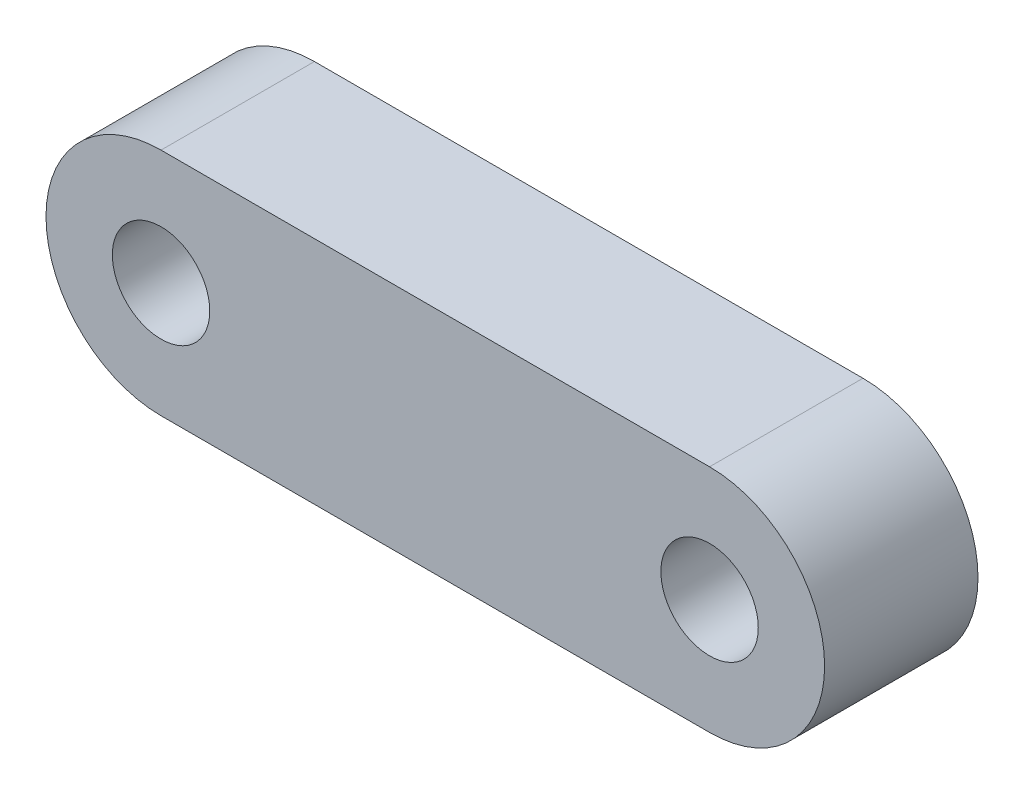
from build123d import *

# Parameters (mm, degrees)
BOSS_EXTRUDE1_DEPTH = 2.5
SKETCH2_R           = 1.5875
CUT_EXTRUDE1_DEPTH  = 15.145621231


with BuildPart() as part:
    # Sketch1 → Boss-Extrude1 (new, symmetric)
    with BuildSketch(Plane.XY):
        with BuildLine():
            Line((-8.94, 3.75), (8.94, 3.75))
            ThreePointArc((8.94, 3.75), (12.69, 0), (8.94, -3.75))
            Line((8.94, -3.75), (-8.94, -3.75))
            ThreePointArc((-8.94, -3.75), (-12.69, 0), (-8.94, 3.75))
        make_face()
    extrude(amount=BOSS_EXTRUDE1_DEPTH, both=True)

    # Sketch2 → Cut-Extrude1 (cut, through all)
    with BuildSketch(Plane.XY.offset(2.5)):
        with Locations((-8.94, 0)):
            Circle(SKETCH2_R)
        with Locations((8.94, 0)):
            Circle(SKETCH2_R)
    extrude(amount=-CUT_EXTRUDE1_DEPTH, mode=Mode.SUBTRACT)


solid = part.part
